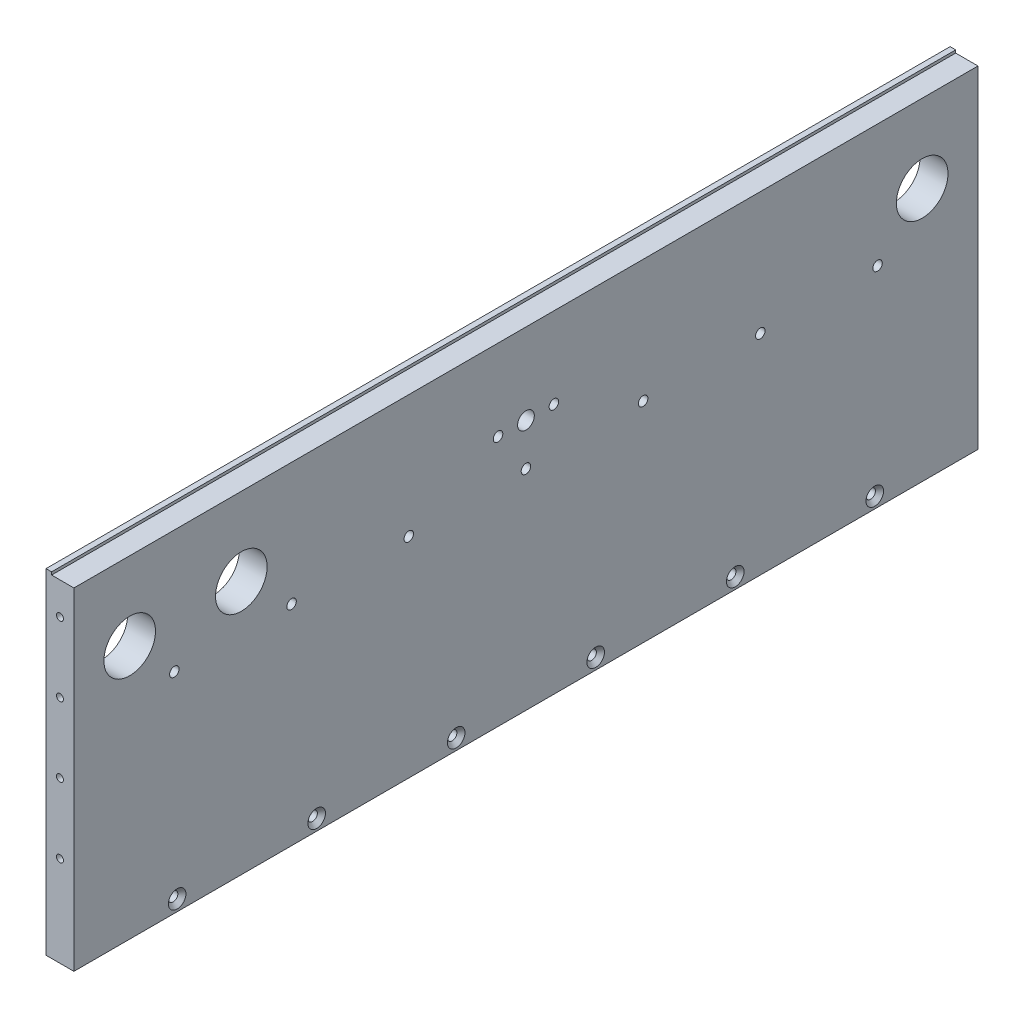
from build123d import *

# Parameters (mm, degrees)
SKETCH1_W                                            = 324
SKETCH1_H                                            = 40
BOSS_EXTRUDE1_DEPTH                                  = 10
G1_4_TAPPED_HOLE1_D                                  = 6
CSK_FOR_M3_COUNTERSUNK_FLAT_HEAD1_D                  = 3.4
CSK_FOR_M3_COUNTERSUNK_FLAT_HEAD1_CSINK_D            = 6.3
CSK_FOR_M3_COUNTERSUNK_FLAT_HEAD1_CSINK_ANGLE        = 90
SKETCH9_W                                            = 10
SKETCH9_H                                            = 324
BOSS_EXTRUDE2_DEPTH                                  = 80
CSK_FOR_M3_COUNTERSUNK_FLAT_HEAD2_D                  = 3.4
CSK_FOR_M3_COUNTERSUNK_FLAT_HEAD2_DEPTH              = 11.5
CSK_FOR_M3_COUNTERSUNK_FLAT_HEAD2_CSINK_D            = 6.3
CSK_FOR_M3_COUNTERSUNK_FLAT_HEAD2_CSINK_ANGLE        = 90
CSK_FOR_M3_COUNTERSUNK_FLAT_HEAD2_TIP                = 1.021463052
M3X0_5_TAPPED_HOLE1_AT_2_COUNT                       = 2
M3X0_5_TAPPED_HOLE1_AT_2_PITCH                       = 25
M3X0_5_TAPPED_HOLE1_AT_3_COUNT                       = 2
M3X0_5_TAPPED_HOLE1_AT_3_PITCH                       = 50
M3X0_5_TAPPED_HOLE1_AT_4_COUNT                       = 2
M3X0_5_TAPPED_HOLE1_AT_4_PITCH                       = 75
SKETCH14_W                                           = 8
SKETCH14_H                                           = 324
CUT_EXTRUDE1_DEPTH                                   = 1
CSK_FOR_M3_CROSS_RECESS_FLAT_HEAD_SCREW1_D           = 3.4
CSK_FOR_M3_CROSS_RECESS_FLAT_HEAD_SCREW1_CSINK_D     = 6.3
CSK_FOR_M3_CROSS_RECESS_FLAT_HEAD_SCREW1_CSINK_ANGLE = 90
LPATTERN1_COUNT                                      = 4
LPATTERN1_PITCH                                      = 42
LPATTERN1_COL_COUNT                                  = 4
LPATTERN1_COL_PITCH                                  = 42
M20X1_5_TAPPED_HOLE1_D                               = 18.5


with BuildPart() as part:
    # Sketch1 → Boss-Extrude1 (new body)
    with BuildSketch(Plane(origin=(0, 0, 0), x_dir=(0, 0, -1), z_dir=(1, 0, 0))):
        Rectangle(SKETCH1_W, SKETCH1_H)
    extrude(amount=BOSS_EXTRUDE1_DEPTH)

    # G1/4 Tapped Hole1 (through all)
    with Locations(Plane(origin=(0, -10, 0), x_dir=(0, 0, -1), z_dir=(-1, 0, 0))):
        with Locations((0, 0)):
            Hole(G1_4_TAPPED_HOLE1_D / 2)

    # CSK for M3 Countersunk Flat Head1 (through all)
    with Locations(Plane(origin=(0, -10, -10), x_dir=(0, 0, -1), z_dir=(-1, 0, 0))):
        with Locations((0, 0)):
            csk_for_m3_countersunk_flat_head1 = CounterSinkHole(CSK_FOR_M3_COUNTERSUNK_FLAT_HEAD1_D / 2, CSK_FOR_M3_COUNTERSUNK_FLAT_HEAD1_CSINK_D / 2, counter_sink_angle=CSK_FOR_M3_COUNTERSUNK_FLAT_HEAD1_CSINK_ANGLE)

    # Mirror1: CSK for M3 Countersunk Flat Head1 across plane
    add(csk_for_m3_countersunk_flat_head1.mirror(Plane.XY), mode=Mode.SUBTRACT)

    # Sketch9 → Boss-Extrude2 (add)
    with BuildSketch(Plane.XZ.offset(20)):
        with Locations((5, 0)):
            Rectangle(SKETCH9_W, SKETCH9_H)
    extrude(amount=BOSS_EXTRUDE2_DEPTH)

    # CSK for M3 Countersunk Flat Head2
    with Locations(Plane(origin=(10, -96, 125), x_dir=(0, 0, 1), z_dir=(1, 0, 0))):
        with Locations((0, 0), (-50, 0), (-100, 0), (-150, 0), (-200, 0), (-250, 0)):
            CounterSinkHole(CSK_FOR_M3_COUNTERSUNK_FLAT_HEAD2_D / 2, CSK_FOR_M3_COUNTERSUNK_FLAT_HEAD2_CSINK_D / 2, depth=CSK_FOR_M3_COUNTERSUNK_FLAT_HEAD2_DEPTH, counter_sink_angle=CSK_FOR_M3_COUNTERSUNK_FLAT_HEAD2_CSINK_ANGLE)
            with Locations((0, 0, -(CSK_FOR_M3_COUNTERSUNK_FLAT_HEAD2_DEPTH + CSK_FOR_M3_COUNTERSUNK_FLAT_HEAD2_TIP / 2))):  # 118° drill point
                Cone(0, CSK_FOR_M3_COUNTERSUNK_FLAT_HEAD2_D / 2, CSK_FOR_M3_COUNTERSUNK_FLAT_HEAD2_TIP, mode=Mode.SUBTRACT)

    # Sketch13 → M3x0.5 Tapped Hole1 (revolve, cut)
    with BuildSketch(Plane(origin=(5, 7.5, 162), x_dir=(0, -1, 0), z_dir=(1, 0, 0))):
        Polygon((0, 0), (0, 12.251075774), (1.25, 11.5), (1.25, 0), align=None)
    m3x0_5_tapped_hole1 = revolve(axis=Axis((5, 7.5, 168.35), (0, 0, -1)), mode=Mode.SUBTRACT)

    # M3x0.5 Tapped Hole1 at 2: M3x0.5 Tapped Hole1 ×2
    with Locations(*[(0, -i * M3X0_5_TAPPED_HOLE1_AT_2_PITCH, 0) for i in range(1, M3X0_5_TAPPED_HOLE1_AT_2_COUNT)]):
        add(m3x0_5_tapped_hole1, mode=Mode.SUBTRACT)

    # M3x0.5 Tapped Hole1 at 3: M3x0.5 Tapped Hole1 ×2
    with Locations(*[(0, -i * M3X0_5_TAPPED_HOLE1_AT_3_PITCH, 0) for i in range(1, M3X0_5_TAPPED_HOLE1_AT_3_COUNT)]):
        add(m3x0_5_tapped_hole1, mode=Mode.SUBTRACT)

    # M3x0.5 Tapped Hole1 at 4: M3x0.5 Tapped Hole1 ×2
    with Locations(*[(0, -i * M3X0_5_TAPPED_HOLE1_AT_4_PITCH, 0) for i in range(1, M3X0_5_TAPPED_HOLE1_AT_4_COUNT)]):
        add(m3x0_5_tapped_hole1, mode=Mode.SUBTRACT)

    # Mirror2: M3x0.5 Tapped Hole1 across plane
    add(m3x0_5_tapped_hole1.mirror(Plane.XY), mode=Mode.SUBTRACT)

    # Mirror2 copy 1 sketch → Mirror2 copy 1 (revolve, cut)
    with BuildSketch(Plane(origin=(5, -17.5, -162), x_dir=(0, -1, 0), z_dir=(1, 0, 0))):
        Polygon((0, 0), (0, -12.251075774), (1.25, -11.5), (1.25, 0), align=None)
    revolve(axis=Axis((5, -17.5, -168.35), (0, 0, -1)), mode=Mode.SUBTRACT)

    # Mirror2 copy 2 sketch → Mirror2 copy 2 (revolve, cut)
    with BuildSketch(Plane(origin=(5, -42.5, -162), x_dir=(0, -1, 0), z_dir=(1, 0, 0))):
        Polygon((0, 0), (0, -12.251075774), (1.25, -11.5), (1.25, 0), align=None)
    revolve(axis=Axis((5, -42.5, -168.35), (0, 0, -1)), mode=Mode.SUBTRACT)

    # Mirror2 copy 3 sketch → Mirror2 copy 3 (revolve, cut)
    with BuildSketch(Plane(origin=(5, -67.5, -162), x_dir=(0, -1, 0), z_dir=(1, 0, 0))):
        Polygon((0, 0), (0, -12.251075774), (1.25, -11.5), (1.25, 0), align=None)
    revolve(axis=Axis((5, -67.5, -168.35), (0, 0, -1)), mode=Mode.SUBTRACT)

    # Sketch14 → Cut-Extrude1 (cut)
    with BuildSketch(Plane(origin=(0, 20, 0), x_dir=(1, 0, 0), z_dir=(0, 1, 0))):
        with Locations((6, 0)):
            Rectangle(SKETCH14_W, SKETCH14_H)
    extrude(amount=-CUT_EXTRUDE1_DEPTH, mode=Mode.SUBTRACT)

    # CSK for M3 Cross Recess Flat Head Screw1 (through all)
    with Locations(Plane(origin=(0, -25, 0), x_dir=(0, 0, -1), z_dir=(-1, 0, 0))):
        with Locations((0, 0)):
            csk_for_m3_cross_recess_flat_head_screw1 = CounterSinkHole(CSK_FOR_M3_CROSS_RECESS_FLAT_HEAD_SCREW1_D / 2, CSK_FOR_M3_CROSS_RECESS_FLAT_HEAD_SCREW1_CSINK_D / 2, counter_sink_angle=CSK_FOR_M3_CROSS_RECESS_FLAT_HEAD_SCREW1_CSINK_ANGLE)

    # LPattern1: CSK for M3 Cross Recess Flat Head Screw1 ×4
    with Locations(*[(0, 0, i * LPATTERN1_PITCH) for i in range(1, LPATTERN1_COUNT)]):
        add(csk_for_m3_cross_recess_flat_head_screw1, mode=Mode.SUBTRACT)

    # LPattern1 col: CSK for M3 Cross Recess Flat Head Screw1 ×4
    with Locations(*[(0, 0, -i * LPATTERN1_COL_PITCH) for i in range(1, LPATTERN1_COL_COUNT)]):
        add(csk_for_m3_cross_recess_flat_head_screw1, mode=Mode.SUBTRACT)

    # M20x1.5 Tapped Hole1 (through all)
    with Locations(Plane(origin=(0, -9, 142), x_dir=(0, 0, -1), z_dir=(-1, 0, 0))):
        with Locations((0, 0), (284, 0), (40, 0)):
            Hole(M20X1_5_TAPPED_HOLE1_D / 2)


solid = part.part
